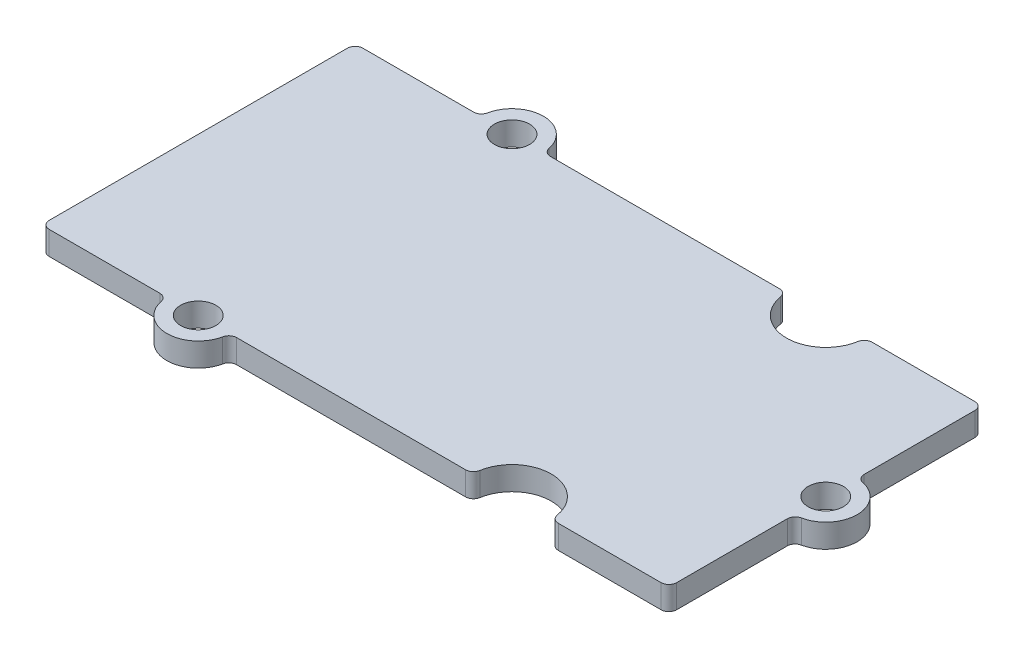
from build123d import *

# Parameters (mm, degrees)
BOSS_EXTRUDE1_DEPTH = 1.5
FILLET1_R           = 0.5
SKETCH2_R           = 1.125
CUT_EXTRUDE1_DEPTH  = 26.104780421


with BuildPart() as part:
    # Sketch1 → Boss-Extrude1 (new body)
    with BuildSketch(Plane(origin=(0, 0, 0), x_dir=(1, 0, 0), z_dir=(0, 1, 0))):
        with BuildLine():
            ThreePointArc((7.5, -10), (10, -7.5), (12.5, -10))
            Line((12.5, -10), (20, -10))
            Line((20, -10), (20, -2))
            ThreePointArc((20, -2), (22, 0), (20, 2))
            Line((20, 2), (20, 10))
            Line((20, 10), (12.5, 10))
            ThreePointArc((12.5, 10), (10, 7.5), (7.5, 10))
            Line((7.5, 10), (-8, 10))
            ThreePointArc((-8, 10), (-10, 12), (-12, 10))
            Line((-12, 10), (-20, 10))
            Line((-20, 10), (-20, -10))
            Line((-20, -10), (-12, -10))
            ThreePointArc((-12, -10), (-10, -12), (-8, -10))
            Line((-8, -10), (7.5, -10))
        make_face()
    extrude(amount=BOSS_EXTRUDE1_DEPTH)

    # Fillet1
    fillet1_edges = [part.edges().sort_by_distance(p)[0] for p in [
        (-8, 0.75, 10),
        (-12, 0.75, 10),
        (-20, 0.75, 10),
        (-20, 0.75, -10),
        (-12, 0.75, -10),
        (-8, 0.75, -10),
        (7.5, 0.75, -10),
        (12.5, 0.75, -10),
        (20, 0.75, -10),
        (20, 0.75, -2),
        (20, 0.75, 2),
        (20, 0.75, 10),
        (12.5, 0.75, 10),
        (7.5, 0.75, 10),
    ]]
    fillet(fillet1_edges, radius=FILLET1_R)

    # Sketch2 → Cut-Extrude1 (cut, through all)
    with BuildSketch(Plane(origin=(0, 1.5, 0), x_dir=(1, 0, 0), z_dir=(0, 1, 0))):
        with Locations(Location((20, 0, 0), (0, 0, 270))):
            Circle(SKETCH2_R)
        with Locations(Location((-10, -10, 0), (0, 0, 270))):
            Circle(SKETCH2_R)
        with Locations(Location((-10, 10, 0), (0, 0, 270))):
            Circle(SKETCH2_R)
    extrude(amount=-CUT_EXTRUDE1_DEPTH, mode=Mode.SUBTRACT)


solid = part.part
